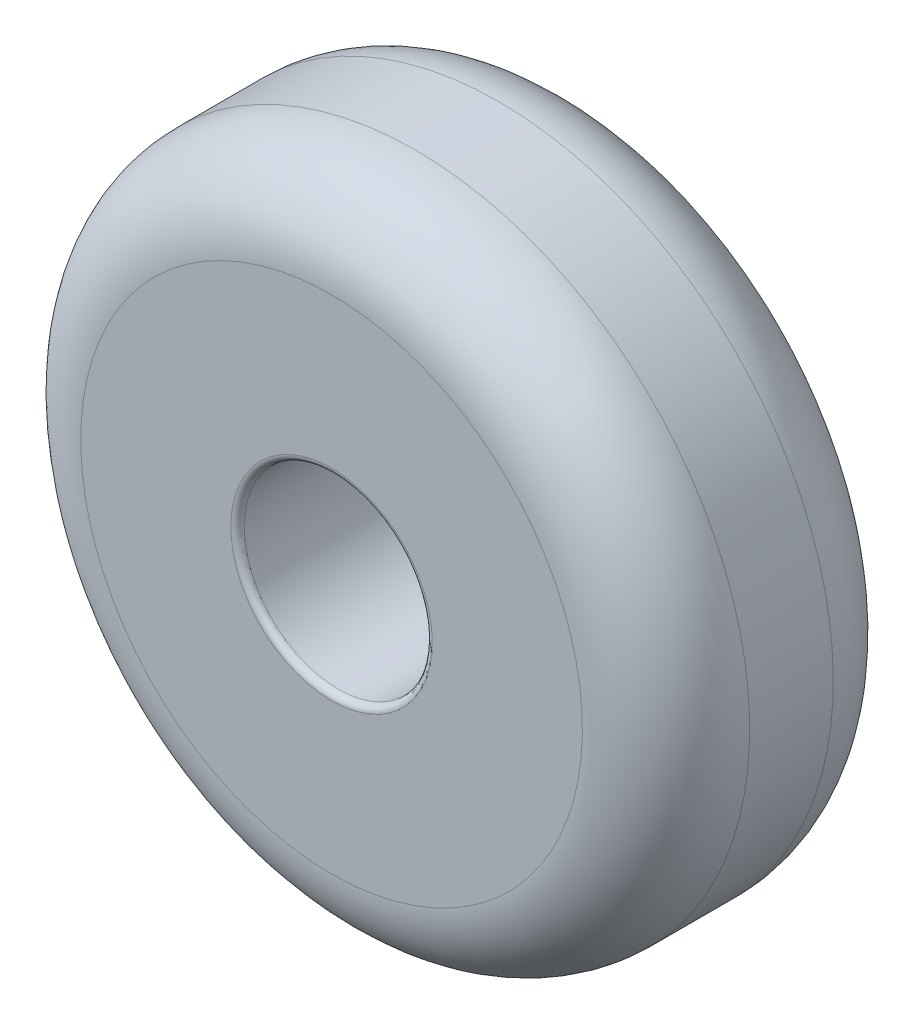
from build123d import *

# Parameters (mm, degrees)
SKETCH1_W = 9.525
SKETCH1_H = 9.128125
FILLET1_R = 3.175
FILLET2_R = 0.254


with BuildPart() as part:
    # Sketch1 → Revolve1 (revolve)
    with BuildSketch(Plane(origin=(0, 0, 0), x_dir=(0, 0, -1), z_dir=(1, 0, 0))):
        with Locations((0, 8.1359375)):
            Rectangle(SKETCH1_W, SKETCH1_H)
    revolve(axis=Axis((0, 0, 0), (0, 0, 1)))

    # Fillet1
    fillet1_edges = [part.edges().sort_by_distance(p)[0] for p in [
        (0, -12.7, -4.7625),
        (0, -12.7, 4.7625),
    ]]
    fillet(fillet1_edges, radius=FILLET1_R)

    # Fillet2
    fillet2_edges = [part.edges().sort_by_distance(p)[0] for p in [
        (0, -3.571875, -4.7625),
        (0, -3.571875, 4.7625),
    ]]
    fillet(fillet2_edges, radius=FILLET2_R)


solid = part.part
